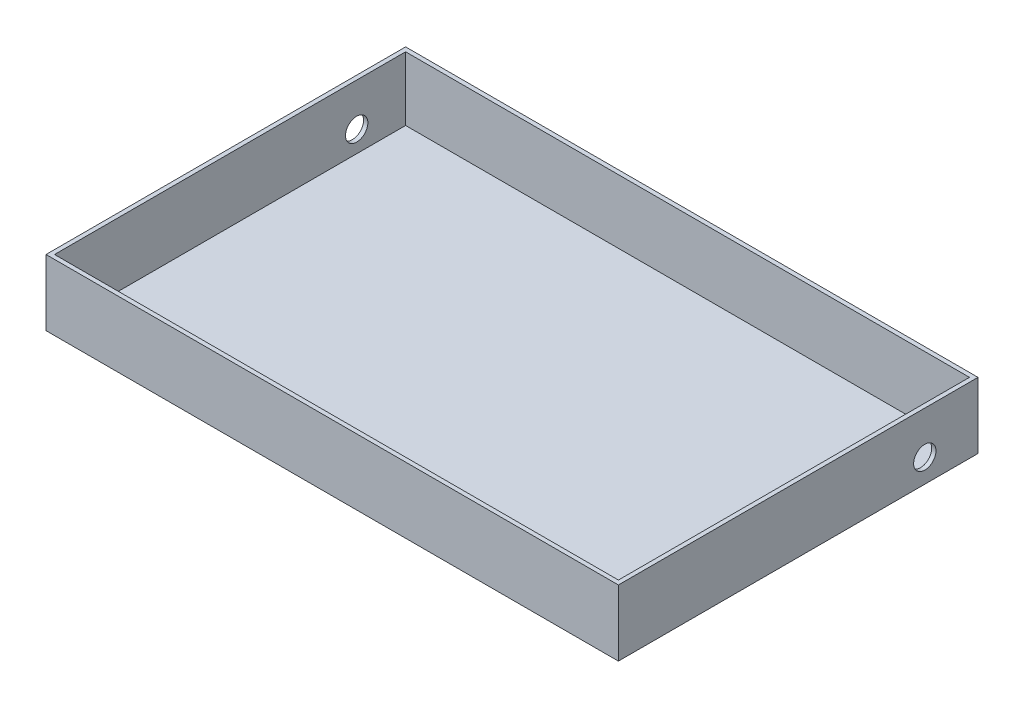
from build123d import *

# Parameters (mm, degrees)
SKETCH2_W           = 269
SKETCH2_H           = 169
SKETCH2_W_2         = 265
SKETCH2_H_2         = 165
WALLS_DEPTH         = 30
SKETCH2_2_W         = 269
SKETCH2_2_H         = 169
BASE_DEPTH          = 1
SKETCH4_R           = 5.25
MOTOR_WHEEL_DEPTH   = 10
MOTOR_WHEEL2_START  = -10
SKETCH3_R           = 5.25
MOTOR_WHEEL2_DEPTH  = 10
SKETCH6_R           = 3.35
CASTER_WHEELS_DEPTH = 10


with BuildPart() as part:
    # Sketch2 → Walls (new body)
    with BuildSketch(Plane(origin=(0, 0, 0), x_dir=(1, 0, 0), z_dir=(0, 1, 0))):
        with Locations((64.006127086, -35.704235294)):
            Rectangle(SKETCH2_W, SKETCH2_H)
        with Locations((64.006127086, -35.704235294)):
            Rectangle(SKETCH2_W_2, SKETCH2_H_2, mode=Mode.SUBTRACT)
    extrude(amount=WALLS_DEPTH)

    # Sketch2<2> → Base (add)
    with BuildSketch(Plane(origin=(0, 0, 0), x_dir=(1, 0, 0), z_dir=(0, 1, 0))):
        with Locations((64.006127086, -35.704235294)):
            Rectangle(SKETCH2_2_W, SKETCH2_2_H)
    extrude(amount=-BASE_DEPTH)

    # Sketch4 → Motor-Wheel (cut)
    with BuildSketch(Plane(origin=(198.506127086, 0, 0), x_dir=(0, 0, -1), z_dir=(1, 0, 0))):
        with Locations((23.795764706, 10)):
            Circle(SKETCH4_R)
    extrude(amount=-MOTOR_WHEEL_DEPTH, mode=Mode.SUBTRACT)

    # Sketch3 → Motor-Wheel2 (cut)
    with BuildSketch(Plane.ZY.offset(70.493872914).offset(MOTOR_WHEEL2_START)):
        with Locations((-23.795764706, 10)):
            Circle(SKETCH3_R)
    extrude(amount=MOTOR_WHEEL2_DEPTH, mode=Mode.SUBTRACT)

    # Sketch6 → Caster Wheels (cut)
    with BuildSketch(Plane(origin=(0, 0, 0), x_dir=(1, 0, 0), z_dir=(0, 1, 0))):
        with Locations((-45.493872914, -95.204235294)):
            Circle(SKETCH6_R)
        with Locations((173.506127086, -95.204235294)):
            Circle(SKETCH6_R)
    extrude(amount=-CASTER_WHEELS_DEPTH, mode=Mode.SUBTRACT)


solid = part.part
